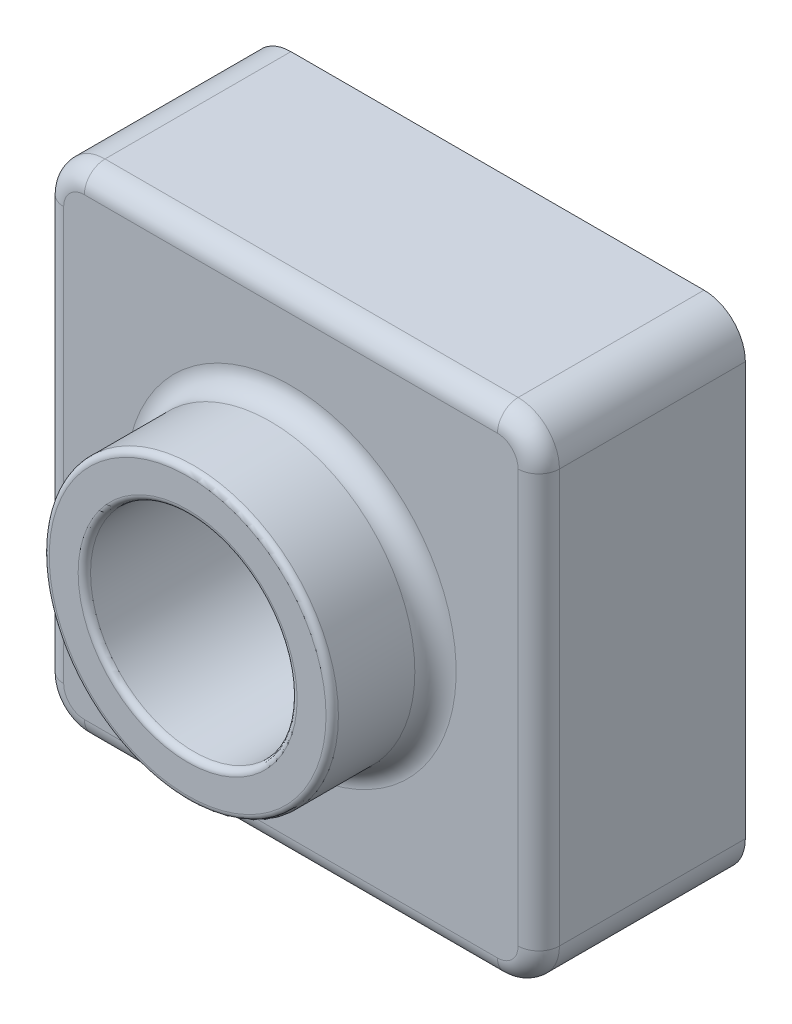
from build123d import *

# Parameters (mm, degrees)
SKETCH9_W           = 120
SKETCH9_H           = 120
BOSS_EXTRUDE6_DEPTH = 50
SKETCH10_R          = 35
BOSS_EXTRUDE7_DEPTH = 25
SKETCH11_R          = 25
CUT_EXTRUDE3_DEPTH  = 186.539753153
FILLET5_R           = 10
FILLET6_R           = 1.5
FILLET7_R           = 5
SHELL3_T            = -2


with BuildPart() as part:
    # Sketch9 → Boss-Extrude6 (new body)
    with BuildSketch(Plane.XY):
        with Locations((60, 60)):
            Rectangle(SKETCH9_W, SKETCH9_H)
    extrude(amount=BOSS_EXTRUDE6_DEPTH)

    # Sketch10 → Boss-Extrude7 (add)
    with BuildSketch(Plane.XY.offset(50)):
        with Locations((60, 60)):
            Circle(SKETCH10_R)
    extrude(amount=BOSS_EXTRUDE7_DEPTH)

    # Sketch11 → Cut-Extrude3 (cut, through all)
    with BuildSketch(Plane.XY.offset(75)):
        with Locations((60, 60)):
            Circle(SKETCH11_R)
    extrude(amount=-CUT_EXTRUDE3_DEPTH, mode=Mode.SUBTRACT)

    # Fillet5
    fillet5_edges = [part.edges().sort_by_distance(p)[0] for p in [
        (0, 120, 25),
        (120, 120, 25),
        (120, 0, 25),
        (0, 0, 25),
    ]]
    fillet(fillet5_edges, radius=FILLET5_R)

    # Fillet6
    fillet6_edges = [part.edges().sort_by_distance(p)[0] for p in [
        (25, 60, 75),
        (35, 60, 75),
    ]]
    fillet(fillet6_edges, radius=FILLET6_R)

    # Fillet7
    fillet7_edges = [part.edges().sort_by_distance(p)[0] for p in [
        (25, 60, 50),
        (0, 60, 50),
        (60, 120, 50),
        (60, 0, 50),
        (120, 60, 50),
        (2.928932188, 2.928932188, 50),
        (117.071067812, 2.928932188, 50),
        (117.071067812, 117.071067812, 50),
        (2.928932188, 117.071067812, 50),
    ]]
    fillet(fillet7_edges, radius=FILLET7_R)

    # Shell3
    shell3_openings = [part.faces().sort_by_distance(p)[0] for p in [
        (60, 1.697056275, 0),
    ]]
    offset(amount=SHELL3_T, openings=shell3_openings, kind=Kind.INTERSECTION)


solid = part.part
